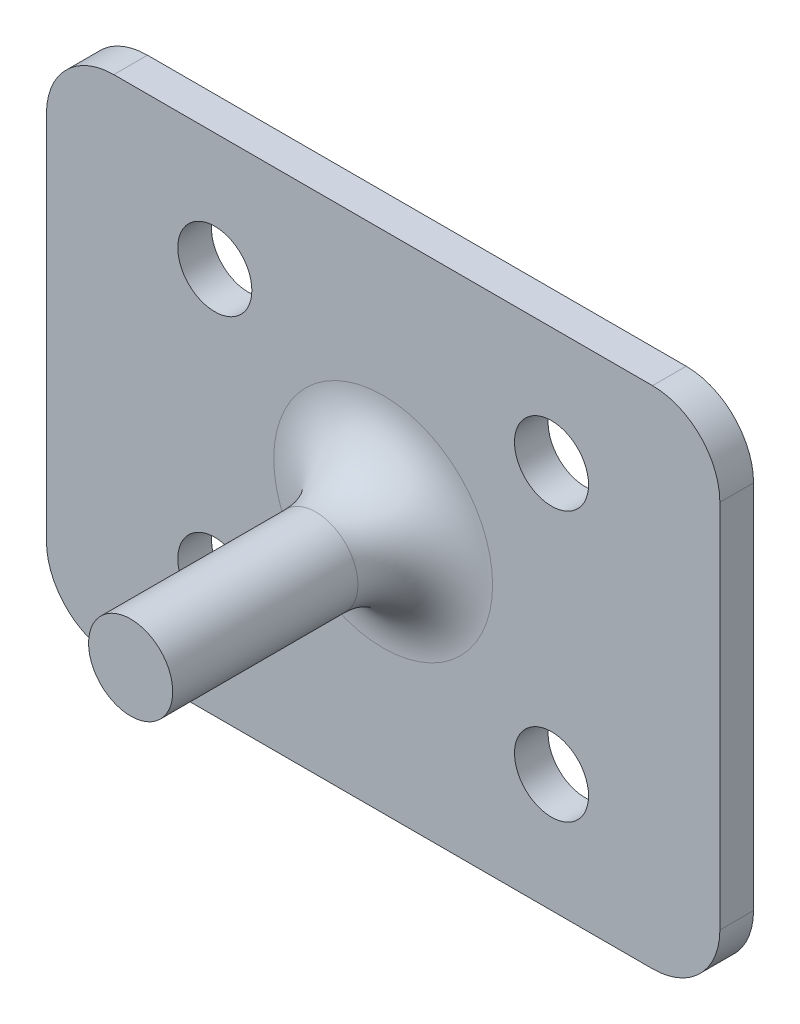
from build123d import *

# Parameters (mm, degrees)
BOSS_EXTRUDE1_DEPTH = 2.54
SKETCH2_R           = 2.794
CUT_EXTRUDE1_DEPTH  = 81.372038048
SKETCH3_R           = 3.175
BOSS_EXTRUDE2_DEPTH = 19.05
FILLET1_R           = 5.08


with BuildPart() as part:
    # Sketch1 → Boss-Extrude1 (new body)
    with BuildSketch(Plane.XY):
        with BuildLine():
            Line((16.51, -12.7), (57.15, -12.7))
            ThreePointArc((57.15, -12.7), (60.742102448, -14.187897552), (62.23, -17.78))
            Line((62.23, -17.78), (62.23, -45.72))
            ThreePointArc((62.23, -45.72), (60.742102448, -49.312102448), (57.15, -50.8))
            Line((57.15, -50.8), (16.51, -50.8))
            ThreePointArc((16.51, -50.8), (12.917897552, -49.312102448), (11.43, -45.72))
            Line((11.43, -45.72), (11.43, -17.78))
            ThreePointArc((11.43, -17.78), (12.917897552, -14.187897552), (16.51, -12.7))
        make_face()
    extrude(amount=BOSS_EXTRUDE1_DEPTH)

    # Sketch2 → Cut-Extrude1 (cut, through all)
    with BuildSketch(Plane.XY.offset(2.54)):
        with Locations((24.13, -21.59)):
            Circle(SKETCH2_R)
        with Locations((49.53, -21.59)):
            Circle(SKETCH2_R)
        with Locations((24.13, -41.91)):
            Circle(SKETCH2_R)
        with Locations((49.53, -41.91)):
            Circle(SKETCH2_R)
    extrude(amount=-CUT_EXTRUDE1_DEPTH, mode=Mode.SUBTRACT)

    # Sketch3 → Boss-Extrude2 (add)
    with BuildSketch(Plane.XY.offset(2.54)):
        with Locations(Location((36.83, -31.75, 0), (0, 0, 180))):
            Circle(SKETCH3_R)
    extrude(amount=BOSS_EXTRUDE2_DEPTH)

    # Fillet1
    fillet1_edges = [part.edges().sort_by_distance(p)[0] for p in [
        (40.005, -31.75, 2.54),
    ]]
    fillet(fillet1_edges, radius=FILLET1_R)


solid = part.part
